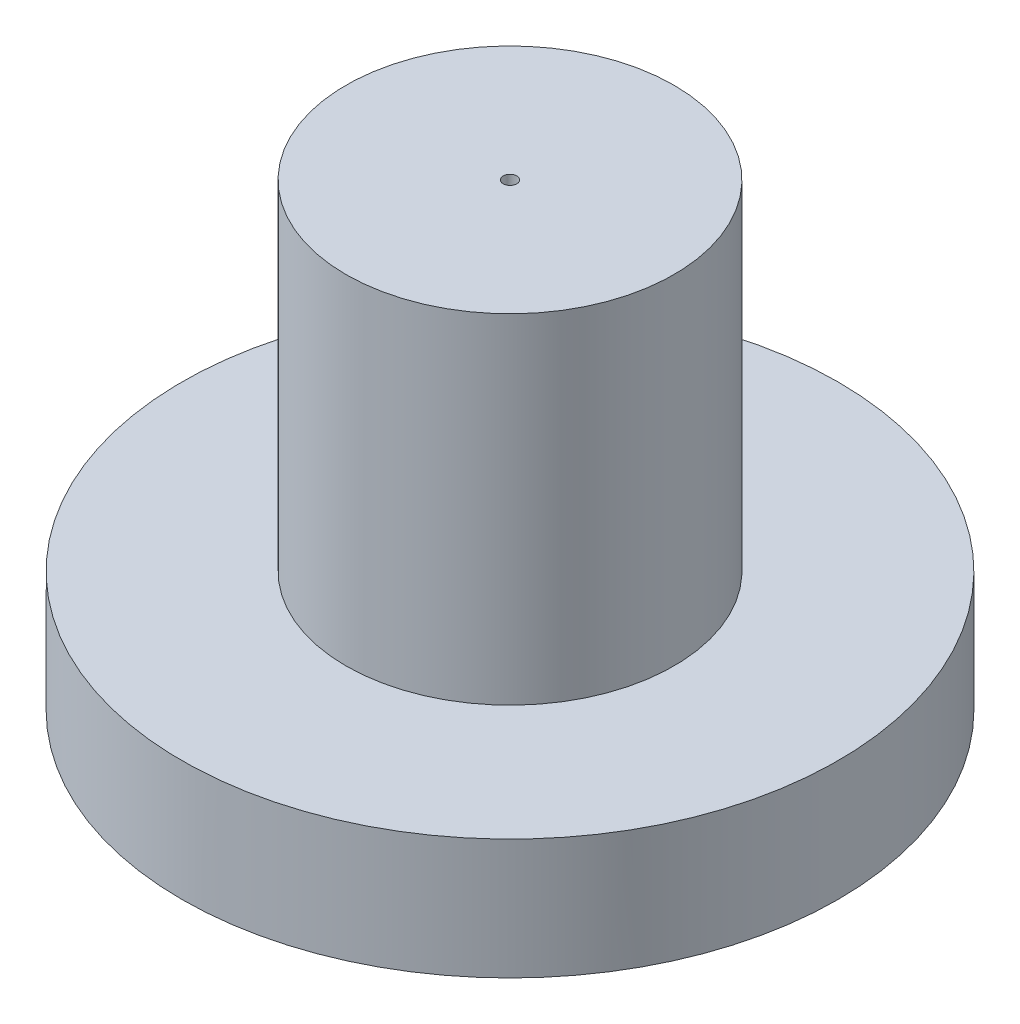
from build123d import *

# Parameters (mm, degrees)
CUT_EXTRUDE1_REACH      = 26.306
CUT_EXTRUDE1_END_RADIUS = 29.375452146
SKETCH4_R               = 0.25


with BuildPart() as part:
    # Sketch1 → Revolve1 (revolve)
    with BuildSketch(Plane.XY, mode=Mode.PRIVATE) as revolve1_sk:
        with BuildLine():
            Line((0, 0), (0, 15.717095385))
            Line((0, 15.717095385), (6, 15.717095385))
            Line((6, 15.717095385), (6, 3.317095385))
            Line((6, 3.317095385), (12, 3.317095385))
            Line((12, 3.317095385), (12, -1.082904615))
            Line((12, -1.082904615), (9.8, -1.682904615))
            ThreePointArc((9.8, -1.682904615), (4.971724247, -0.423782992), (0, 0))
        make_face()
    revolve(revolve1_sk.sketch.rotate(Axis((0, 0, 0), (0, 1, 0)), 90), axis=Axis((0, 0, 0), (0, 1, 0)))

    # Cut-Extrude1: up to this sphere (the profile starts outside it)
    cut_extrude1_end = Location((0, -29.375452146, 0)) * Sphere(CUT_EXTRUDE1_END_RADIUS, mode=Mode.PRIVATE)
    # Sketch4 → Cut-Extrude1 (cut, up to the surface)
    with BuildSketch(Plane(origin=(0, 15.717095385, 0), x_dir=(1, 0, 0), z_dir=(0, 1, 0)), mode=Mode.PRIVATE) as cut_extrude1_sk1:
        with Locations(Location((0, 0, 0), (0, 0, 270))):
            Circle(SKETCH4_R)
    cut_extrude1_tool1 = extrude(cut_extrude1_sk1.sketch, amount=-CUT_EXTRUDE1_REACH, mode=Mode.PRIVATE) - cut_extrude1_end
    add(cut_extrude1_tool1.solids().sort_by_distance((0, 15.717095, 0))[0], mode=Mode.SUBTRACT)


with BuildPart() as body_2:
    # Sketch3 → Revolve2 (revolve)
    with BuildSketch(Plane.XY):
        with BuildLine():
            ThreePointArc((1.5, -0.03832228), (0.750244726, -0.009582133), (0, 0))
            Line((0, 0), (0, -1.154286574))
            ThreePointArc((0, -1.154286574), (0.934796275, -0.844694465), (1.5, -0.03832228))
        make_face()
    revolve(axis=Axis((0, 0, 0), (0, 1, 0)))


with BuildPart() as body_3:
    # Sketch5 → Revolve3 (revolve)
    with BuildSketch(Plane.XY):
        with BuildLine():
            ThreePointArc((4, -0.273610473), (2.004673458, -0.068482444), (0, 0))
            Line((0, 0), (0, -1.713499762))
            ThreePointArc((0, -1.713499762), (2.125634092, -1.342565538), (4, -0.273610473))
        make_face()
    revolve(axis=Axis((0, 0, 0), (0, 1, 0)))


with BuildPart() as body_4:
    # Sketch7 → Revolve4 (revolve)
    with BuildSketch(Plane.XY):
        with BuildLine():
            Line((0, 0), (0, -4.135168159))
            ThreePointArc((0, -4.135168159), (5.051079006, -3.5127946), (9.8, -1.682904615))
            ThreePointArc((9.8, -1.682904615), (4.971724247, -0.423782992), (0, 0))
        make_face()
    revolve(axis=Axis((0, 0, 0), (0, -1, 0)))


solid = Compound([part.part, body_2.part, body_3.part, body_4.part])
